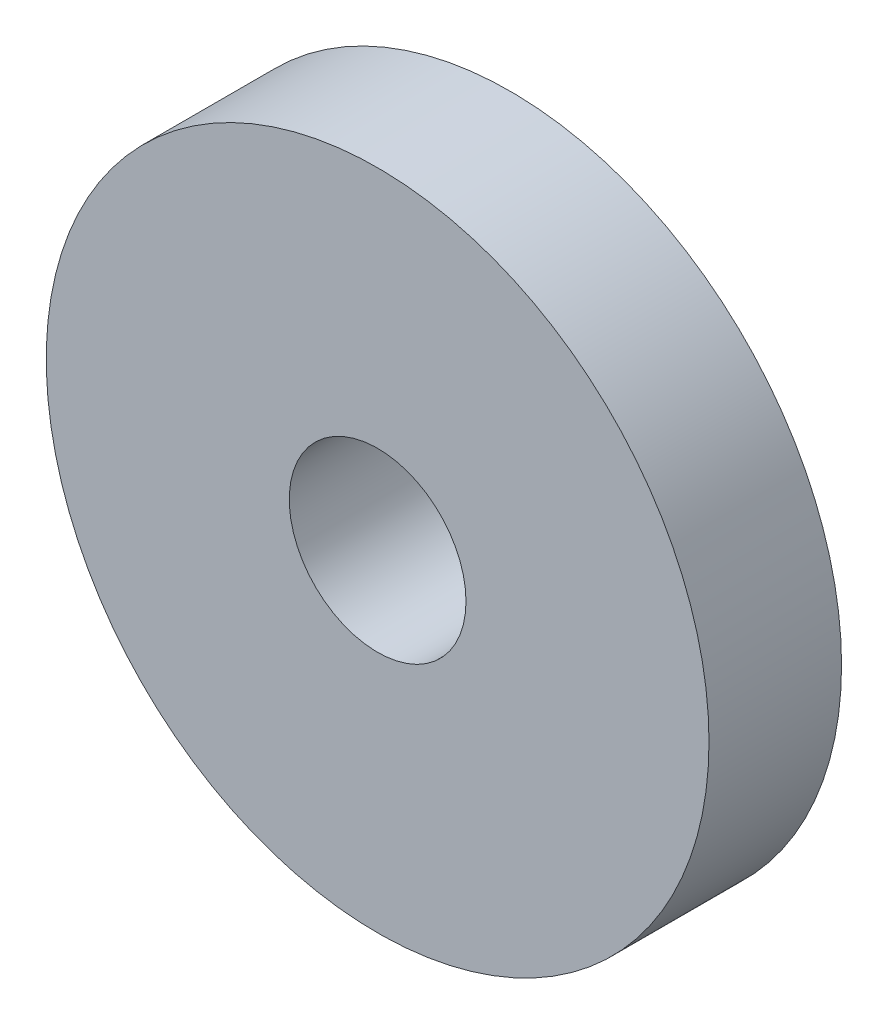
from build123d import *

# Parameters (mm, degrees)
SKETCH_1_R      = 7.5
SKETCH_1_R_2    = 2
EXTRUDE_1_DEPTH = 3


with BuildPart() as part:
    # 草图1 → 凸台-拉伸1 (new body)
    with BuildSketch(Plane.XY):
        Circle(SKETCH_1_R)
        Circle(SKETCH_1_R_2, mode=Mode.SUBTRACT)
    extrude(amount=EXTRUDE_1_DEPTH)


solid = part.part
